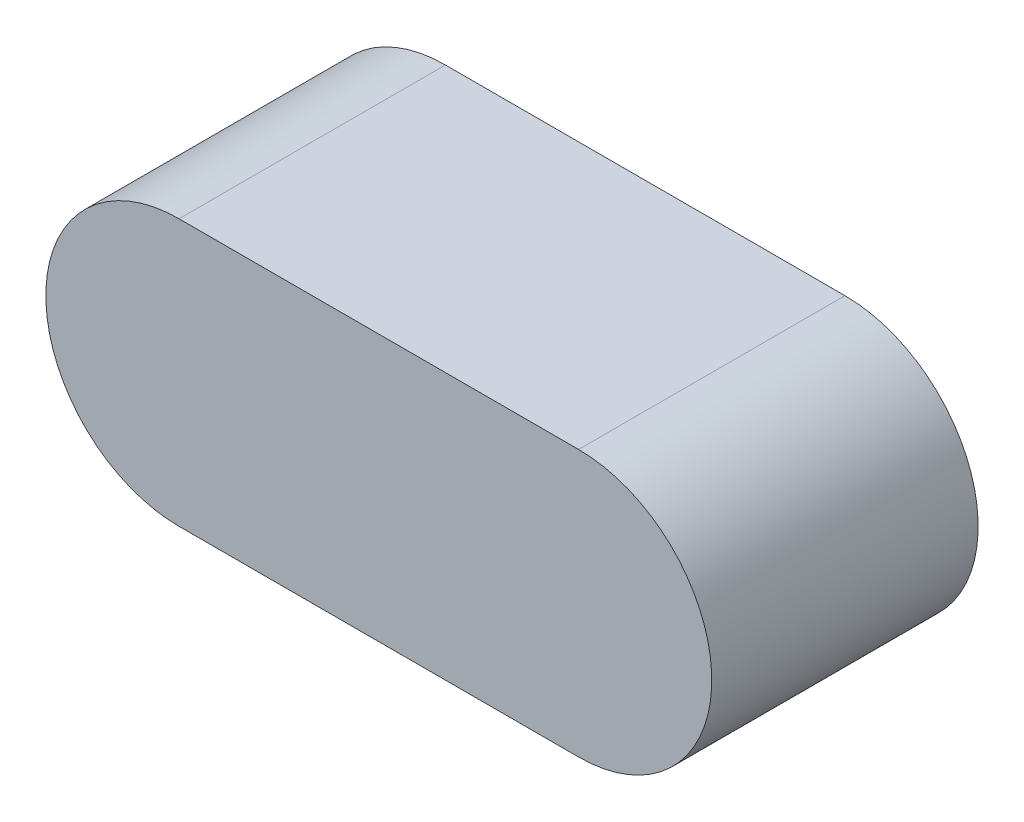
from build123d import *

# Parameters (mm, degrees)
SKETCH1_W         = 10
SKETCH1_H         = 4
EXTRUDE1_DEPTH    = 4
SKETCH2_OUTSIDE_W = 14.298
SKETCH2_OUTSIDE_H = 8.298
EXTRUDE2_DEPTH    = 51.679631017


with BuildPart() as part:
    # Sketch1 → Extrude1 (new body)
    with BuildSketch(Plane(origin=(0, 0, 0), x_dir=(1, 0, 0), z_dir=(0, 1, 0))):
        Rectangle(SKETCH1_W, SKETCH1_H)
    extrude(amount=-EXTRUDE1_DEPTH)

    # Sketch2 outside → Extrude2 (cut, through all)
    with BuildSketch(Plane(origin=(44.45, 6.35, 2), x_dir=(-1, 0, 0), z_dir=(0, 0, -1))):
        with Locations((44.45, -8.35)):
            Rectangle(SKETCH2_OUTSIDE_W, SKETCH2_OUTSIDE_H)
        with BuildLine():
            Line((41.45, -6.35), (47.45, -6.35))
            ThreePointArc((47.45, -6.35), (49.45, -8.35), (47.45, -10.35))
            Line((47.45, -10.35), (41.45, -10.35))
            ThreePointArc((41.45, -10.35), (39.45, -8.35), (41.45, -6.35))
        make_face(mode=Mode.SUBTRACT)
    extrude(amount=EXTRUDE2_DEPTH, mode=Mode.SUBTRACT)


solid = part.part
